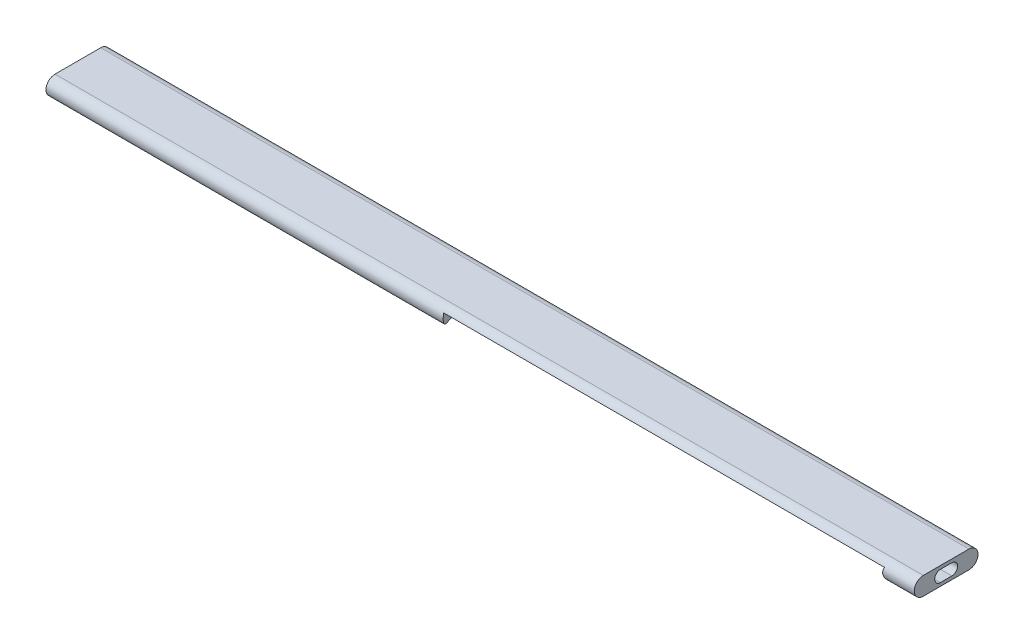
from build123d import *

# Parameters (mm, degrees)
EXTRUDE_1_DEPTH     = 380
CUT_EXTRUDE_1_DEPTH = 390
CUT_EXTRUDE_2_DEPTH = 5.9


with BuildPart() as part:
    # 草图2 → 凸台-拉伸1 (new body)
    with BuildSketch(Plane(origin=(0, 0, 0), x_dir=(0, 0, -1), z_dir=(1, 0, 0))):
        with BuildLine():
            Line((-10, 3.95), (10, 3.95))
            ThreePointArc((10, 3.95), (13.95, 0), (10, -3.95))
            Line((10, -3.95), (-10, -3.95))
            ThreePointArc((-10, -3.95), (-13.95, 0), (-10, 3.95))
        make_face()
    extrude(amount=EXTRUDE_1_DEPTH)

    # 草图3 → 切除-拉伸1 (cut)
    with BuildSketch(Plane.ZY):
        with BuildLine():
            Line((2.5, -2.5), (-2.5, -2.5))
            ThreePointArc((-2.5, -2.5), (-5, 0), (-2.5, 2.5))
            Line((-2.5, 2.5), (2.5, 2.5))
            ThreePointArc((2.5, 2.5), (5, 0), (2.5, -2.5))
        make_face()
    extrude(amount=-CUT_EXTRUDE_1_DEPTH, mode=Mode.SUBTRACT)

    # 草图5 → 切除-拉伸2 (cut)
    with BuildSketch(Plane.XZ.offset(3.95)):
        with BuildLine():
            Line((197.278769414, 27.278769414), (342.721230586, 27.278769414))
            ThreePointArc((342.721230586, 27.278769414), (370, 0), (342.721230586, -27.278769414))
            Line((342.721230586, -27.278769414), (197.278769414, -27.278769414))
            ThreePointArc((197.278769414, -27.278769414), (170, 0), (197.278769414, 27.278769414))
        make_face()
    extrude(amount=-CUT_EXTRUDE_2_DEPTH, mode=Mode.SUBTRACT)


solid = part.part
